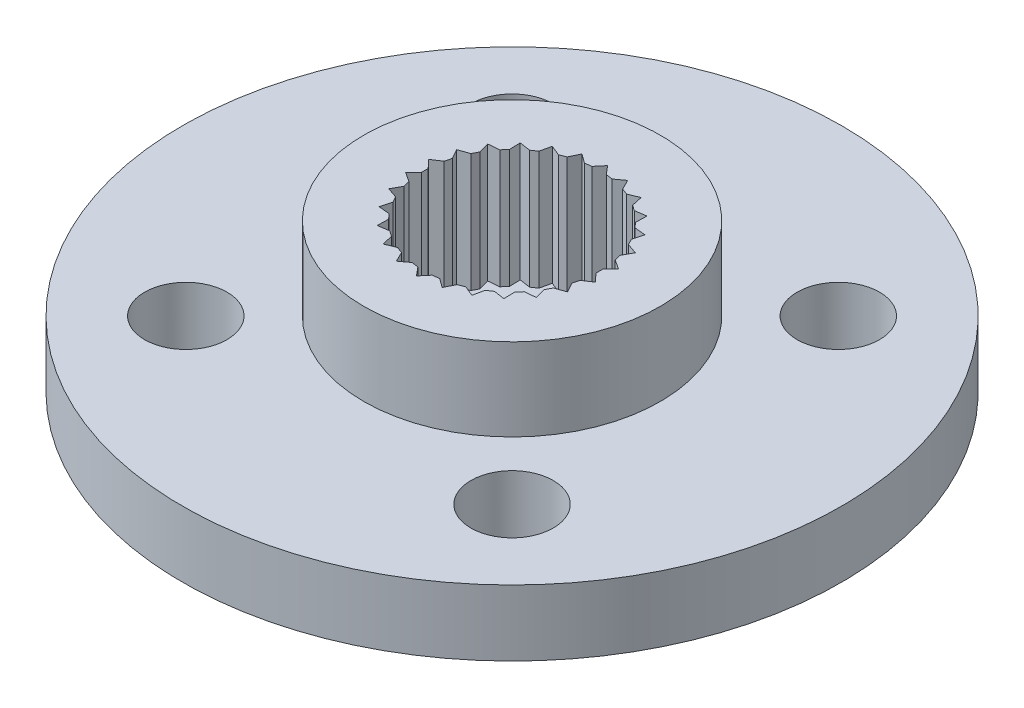
from build123d import *

# Parameters (mm, degrees)
SKETCH1_W                      = 10
SKETCH1_H                      = 2
SKETCH2_R                      = 4.5
BOSS_EXTRUDE1_DEPTH            = 2.5
CUT_EXTRUDE1_DEPTH             = 3.6
F_3_0_3_DIAMETER_HOLE1_D       = 3
F_3_0_3_DIAMETER_HOLE1_DEPTH   = 4.5
F_2_5_2_5_DIAMETER_HOLE1_D     = 2.5
F_2_5_2_5_DIAMETER_HOLE1_DEPTH = 4.5
CHAMFER1_SIZE                  = 0.140560122
CHAMFER1_EDGE_2_SIZE           = 0.140560122
CHAMFER1_EDGE_3_SIZE           = 0.140560122
CHAMFER1_EDGE_4_SIZE           = 0.140560122
CHAMFER1_EDGE_5_SIZE           = 0.140560122
CHAMFER1_EDGE_6_SIZE           = 0.140560122
CHAMFER1_EDGE_7_SIZE           = 0.140560122
CHAMFER1_EDGE_8_SIZE           = 0.140560122
CHAMFER1_EDGE_9_SIZE           = 0.140560122
CHAMFER1_EDGE_10_SIZE          = 0.140560122
CHAMFER1_EDGE_11_SIZE          = 0.140560122
CHAMFER1_EDGE_12_SIZE          = 0.140560122
CHAMFER1_EDGE_13_SIZE          = 0.140560122
CHAMFER1_EDGE_14_SIZE          = 0.140560122
CHAMFER1_EDGE_15_SIZE          = 0.140560122
CHAMFER1_EDGE_16_SIZE          = 0.140560122
CHAMFER1_EDGE_17_SIZE          = 0.140560122
CHAMFER1_EDGE_18_SIZE          = 0.140560122
CHAMFER1_EDGE_19_SIZE          = 0.140560122
CHAMFER1_EDGE_20_SIZE          = 0.140560122
CHAMFER1_EDGE_21_SIZE          = 0.140560122
CHAMFER1_EDGE_22_SIZE          = 0.140560122
CHAMFER1_EDGE_23_SIZE          = 0.140560122
CHAMFER1_EDGE_24_SIZE          = 0.140560122
CHAMFER1_EDGE_25_SIZE          = 0.140560122
CHAMFER1_EDGE_26_SIZE          = 0.140560122


with BuildPart() as part:
    # Sketch1 → Revolve1 (revolve)
    with BuildSketch(Plane.XY, mode=Mode.PRIVATE) as revolve1_sk:
        with Locations((5, 1)):
            Rectangle(SKETCH1_W, SKETCH1_H)
    revolve(revolve1_sk.sketch.rotate(Axis((0, 2, 0), (0, -1, 0)), 270), axis=Axis((0, 2, 0), (0, -1, 0)))

    # Sketch2 → Boss-Extrude1 (add)
    with BuildSketch(Plane(origin=(0, 2, 0), x_dir=(-1, 0, 0), z_dir=(0, 1, 0))):
        with Locations(Location((0, 0, 0), (0, 0, 90))):
            Circle(SKETCH2_R)
    extrude(amount=BOSS_EXTRUDE1_DEPTH)

    # Sketch3 → Cut-Extrude1 (cut)
    with BuildSketch(Plane(origin=(0, 4.5, 0), x_dir=(-1, 0, 0), z_dir=(0, 1, 0))):
        Polygon((-2.477853855, 0.610736123), (-2.878855735, 0.349556373), (-2.552010646, 0), (-2.878855735, -0.349556373), (-2.477853855, -0.610736123), (-2.711547104, -1.028354172), (-2.259693204, -1.185978483), (-2.386653211, -1.647387766), (-1.910207398, -1.692296084), (-1.923055709, -2.17068117), (-1.449707281, -2.100263587), (-1.347697199, -2.567822474), (-0.904955447, -2.386171406), (-0.694015426, -2.815731271), (-0.307610891, -2.533403615), (0, -2.9), (0.307610891, -2.533403615), (0.694015426, -2.815731271), (0.904955447, -2.386171406), (1.347697199, -2.567822474), (1.449707281, -2.100263587), (1.923055709, -2.17068117), (1.910207398, -1.692296084), (2.386653211, -1.647387766), (2.259693204, -1.185978483), (2.711547104, -1.028354172), (2.477853855, -0.610736123), (2.878855735, -0.349556373), (2.552010646, 0), (2.878855735, 0.349556373), (2.477853855, 0.610736123), (2.711547104, 1.028354172), (2.259693204, 1.185978483), (2.386653211, 1.647387766), (1.910207398, 1.692296084), (1.923055709, 2.17068117), (1.449707281, 2.100263587), (1.347697199, 2.567822474), (0.904955447, 2.386171406), (0.694015426, 2.815731271), (0.307610891, 2.533403615), (0, 2.9), (-0.307610891, 2.533403615), (-0.694015426, 2.815731271), (-0.904955447, 2.386171406), (-1.347697199, 2.567822474), (-1.449707281, 2.100263587), (-1.923055709, 2.17068117), (-1.910207398, 1.692296084), (-2.386653211, 1.647387766), (-2.259693204, 1.185978483), (-2.711547104, 1.028354172), align=None)
    extrude(amount=-CUT_EXTRUDE1_DEPTH, mode=Mode.SUBTRACT)

    # Ø3.0 (3) Diameter Hole1
    with Locations(Plane(origin=(0, 0, 0), x_dir=(-1, 0, 0), z_dir=(0, -1, 0))):
        with Locations((0, 0)):
            Hole(F_3_0_3_DIAMETER_HOLE1_D / 2, depth=F_3_0_3_DIAMETER_HOLE1_DEPTH)

    # Ø2.5 (2.5) Diameter Hole1
    with Locations(Plane(origin=(0, 0, 0), x_dir=(-1, 0, 0), z_dir=(0, -1, 0))):
        with Locations((4.949747468, -4.949747468), (-4.949747468, -4.949747468), (-4.949747468, 4.949747468), (4.949747468, 4.949747468)):
            Hole(F_2_5_2_5_DIAMETER_HOLE1_D / 2, depth=F_2_5_2_5_DIAMETER_HOLE1_DEPTH)

    # Chamfer1
    chamfer1_edges = [part.edges().sort_by_distance(p)[0] for p in [
        (2.477853855, 2.7, 0.610736123),
    ]]
    chamfer(chamfer1_edges, length=CHAMFER1_SIZE)

    # Chamfer1 edge 2
    chamfer1_edge_2_edges = [part.edges().sort_by_distance(p)[0] for p in [
        (2.259693204, 2.7, 1.185978483),
    ]]
    chamfer(chamfer1_edge_2_edges, length=CHAMFER1_EDGE_2_SIZE)

    # Chamfer1 edge 3
    chamfer1_edge_3_edges = [part.edges().sort_by_distance(p)[0] for p in [
        (1.910207398, 2.7, 1.692296084),
    ]]
    chamfer(chamfer1_edge_3_edges, length=CHAMFER1_EDGE_3_SIZE)

    # Chamfer1 edge 4
    chamfer1_edge_4_edges = [part.edges().sort_by_distance(p)[0] for p in [
        (1.449707281, 2.7, 2.100263587),
    ]]
    chamfer(chamfer1_edge_4_edges, length=CHAMFER1_EDGE_4_SIZE)

    # Chamfer1 edge 5
    chamfer1_edge_5_edges = [part.edges().sort_by_distance(p)[0] for p in [
        (0.904955447, 2.7, 2.386171406),
    ]]
    chamfer(chamfer1_edge_5_edges, length=CHAMFER1_EDGE_5_SIZE)

    # Chamfer1 edge 6
    chamfer1_edge_6_edges = [part.edges().sort_by_distance(p)[0] for p in [
        (0.307610891, 2.7, 2.533403615),
    ]]
    chamfer(chamfer1_edge_6_edges, length=CHAMFER1_EDGE_6_SIZE)

    # Chamfer1 edge 7
    chamfer1_edge_7_edges = [part.edges().sort_by_distance(p)[0] for p in [
        (-0.307610891, 2.7, 2.533403615),
    ]]
    chamfer(chamfer1_edge_7_edges, length=CHAMFER1_EDGE_7_SIZE)

    # Chamfer1 edge 8
    chamfer1_edge_8_edges = [part.edges().sort_by_distance(p)[0] for p in [
        (-0.904955447, 2.7, 2.386171406),
    ]]
    chamfer(chamfer1_edge_8_edges, length=CHAMFER1_EDGE_8_SIZE)

    # Chamfer1 edge 9
    chamfer1_edge_9_edges = [part.edges().sort_by_distance(p)[0] for p in [
        (-1.449707281, 2.7, 2.100263587),
    ]]
    chamfer(chamfer1_edge_9_edges, length=CHAMFER1_EDGE_9_SIZE)

    # Chamfer1 edge 10
    chamfer1_edge_10_edges = [part.edges().sort_by_distance(p)[0] for p in [
        (-1.910207398, 2.7, 1.692296084),
    ]]
    chamfer(chamfer1_edge_10_edges, length=CHAMFER1_EDGE_10_SIZE)

    # Chamfer1 edge 11
    chamfer1_edge_11_edges = [part.edges().sort_by_distance(p)[0] for p in [
        (-2.259693204, 2.7, 1.185978483),
    ]]
    chamfer(chamfer1_edge_11_edges, length=CHAMFER1_EDGE_11_SIZE)

    # Chamfer1 edge 12
    chamfer1_edge_12_edges = [part.edges().sort_by_distance(p)[0] for p in [
        (-2.477853855, 2.7, 0.610736123),
    ]]
    chamfer(chamfer1_edge_12_edges, length=CHAMFER1_EDGE_12_SIZE)

    # Chamfer1 edge 13
    chamfer1_edge_13_edges = [part.edges().sort_by_distance(p)[0] for p in [
        (-2.552010646, 2.7, 0),
    ]]
    chamfer(chamfer1_edge_13_edges, length=CHAMFER1_EDGE_13_SIZE)

    # Chamfer1 edge 14
    chamfer1_edge_14_edges = [part.edges().sort_by_distance(p)[0] for p in [
        (-2.477853855, 2.7, -0.610736123),
    ]]
    chamfer(chamfer1_edge_14_edges, length=CHAMFER1_EDGE_14_SIZE)

    # Chamfer1 edge 15
    chamfer1_edge_15_edges = [part.edges().sort_by_distance(p)[0] for p in [
        (-2.259693204, 2.7, -1.185978483),
    ]]
    chamfer(chamfer1_edge_15_edges, length=CHAMFER1_EDGE_15_SIZE)

    # Chamfer1 edge 16
    chamfer1_edge_16_edges = [part.edges().sort_by_distance(p)[0] for p in [
        (-1.910207398, 2.7, -1.692296084),
    ]]
    chamfer(chamfer1_edge_16_edges, length=CHAMFER1_EDGE_16_SIZE)

    # Chamfer1 edge 17
    chamfer1_edge_17_edges = [part.edges().sort_by_distance(p)[0] for p in [
        (-1.449707281, 2.7, -2.100263587),
    ]]
    chamfer(chamfer1_edge_17_edges, length=CHAMFER1_EDGE_17_SIZE)

    # Chamfer1 edge 18
    chamfer1_edge_18_edges = [part.edges().sort_by_distance(p)[0] for p in [
        (-0.904955447, 2.7, -2.386171406),
    ]]
    chamfer(chamfer1_edge_18_edges, length=CHAMFER1_EDGE_18_SIZE)

    # Chamfer1 edge 19
    chamfer1_edge_19_edges = [part.edges().sort_by_distance(p)[0] for p in [
        (-0.307610891, 2.7, -2.533403615),
    ]]
    chamfer(chamfer1_edge_19_edges, length=CHAMFER1_EDGE_19_SIZE)

    # Chamfer1 edge 20
    chamfer1_edge_20_edges = [part.edges().sort_by_distance(p)[0] for p in [
        (0.307610891, 2.7, -2.533403615),
    ]]
    chamfer(chamfer1_edge_20_edges, length=CHAMFER1_EDGE_20_SIZE)

    # Chamfer1 edge 21
    chamfer1_edge_21_edges = [part.edges().sort_by_distance(p)[0] for p in [
        (0.904955447, 2.7, -2.386171406),
    ]]
    chamfer(chamfer1_edge_21_edges, length=CHAMFER1_EDGE_21_SIZE)

    # Chamfer1 edge 22
    chamfer1_edge_22_edges = [part.edges().sort_by_distance(p)[0] for p in [
        (1.449707281, 2.7, -2.100263587),
    ]]
    chamfer(chamfer1_edge_22_edges, length=CHAMFER1_EDGE_22_SIZE)

    # Chamfer1 edge 23
    chamfer1_edge_23_edges = [part.edges().sort_by_distance(p)[0] for p in [
        (1.910207398, 2.7, -1.692296084),
    ]]
    chamfer(chamfer1_edge_23_edges, length=CHAMFER1_EDGE_23_SIZE)

    # Chamfer1 edge 24
    chamfer1_edge_24_edges = [part.edges().sort_by_distance(p)[0] for p in [
        (2.259693204, 2.7, -1.185978483),
    ]]
    chamfer(chamfer1_edge_24_edges, length=CHAMFER1_EDGE_24_SIZE)

    # Chamfer1 edge 25
    chamfer1_edge_25_edges = [part.edges().sort_by_distance(p)[0] for p in [
        (2.477853855, 2.7, -0.610736123),
    ]]
    chamfer(chamfer1_edge_25_edges, length=CHAMFER1_EDGE_25_SIZE)

    # Chamfer1 edge 26
    chamfer1_edge_26_edges = [part.edges().sort_by_distance(p)[0] for p in [
        (2.552010646, 2.7, 0),
    ]]
    chamfer(chamfer1_edge_26_edges, length=CHAMFER1_EDGE_26_SIZE)


solid = part.part
